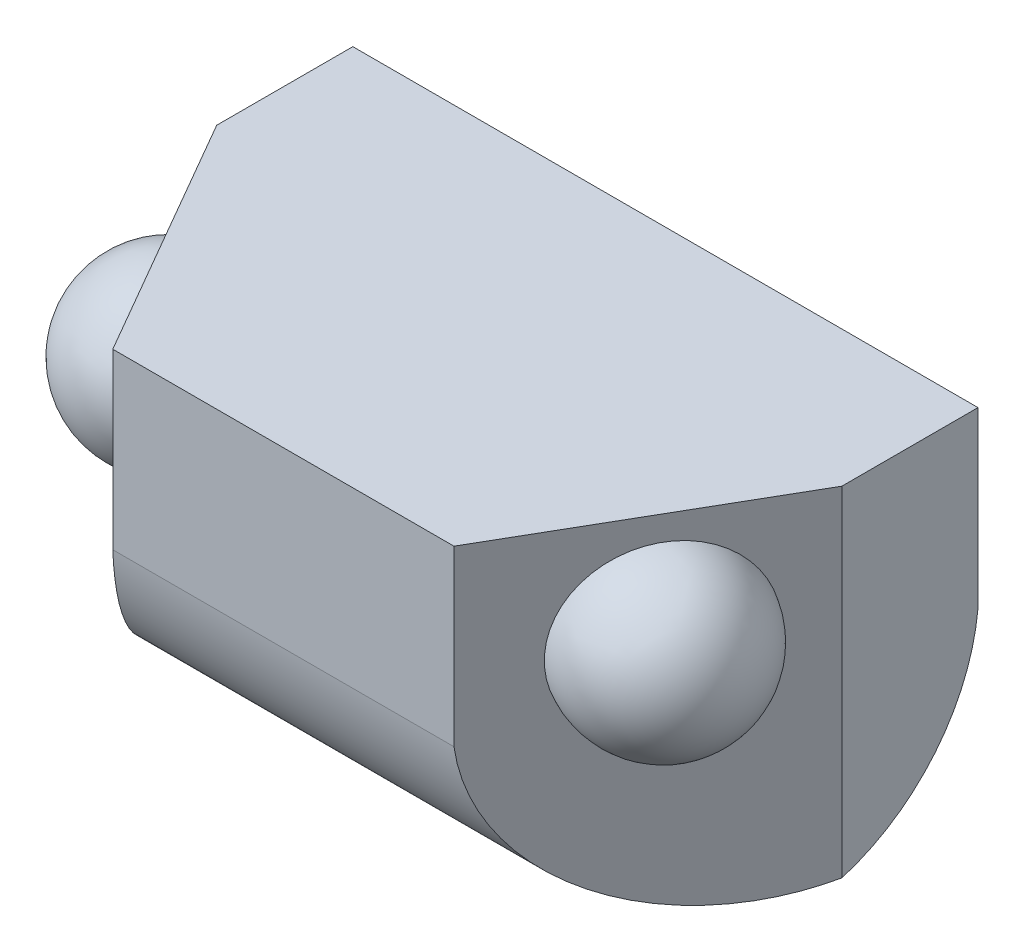
from build123d import *

# Parameters (mm, degrees)
SKETCH1_W                = 180
SKETCH1_H                = 110
BOSS_EXTRUDE1_DEPTH      = 50
BOSS_EXTRUDE2_DEPTH      = 180
CUT_EXTRUDE1_DEPTH       = 146.344418537
BOSS_EXTRUDE5_DEPTH      = 10
BOSS_EXTRUDE5_DEPTH_BACK = 10
SKETCH5_R                = 5


with BuildPart() as part:
    # Sketch1 → Boss-Extrude1 (new body)
    with BuildSketch(Plane(origin=(0, 0, 0), x_dir=(1, 0, 0), z_dir=(0, 1, 0))):
        Rectangle(SKETCH1_W, SKETCH1_H)
    extrude(amount=BOSS_EXTRUDE1_DEPTH)

    # Sketch2 → Boss-Extrude2 (add)
    with BuildSketch(Plane.ZY.offset(90)):
        with BuildLine():
            Line((-55, 0), (55, 0))
            ThreePointArc((55, 0), (0, -50), (-55, 0))
        make_face()
    extrude(amount=-BOSS_EXTRUDE2_DEPTH)

    # Sketch3 → Cut-Extrude1 (cut, through all)
    with BuildSketch(Plane(origin=(0, 50, 0), x_dir=(1, 0, 0), z_dir=(0, 1, 0))):
        Polygon((-49.118803686, -55), (-90, 15.808309091), (-90, -55), align=None)
    cut_extrude1 = extrude(amount=-CUT_EXTRUDE1_DEPTH, mode=Mode.SUBTRACT)

    # Mirror1: Cut-Extrude1 across plane
    add(cut_extrude1.mirror(Plane(origin=(0, 0, 0), x_dir=(0, 0, 1), z_dir=(1, 0, 0))), mode=Mode.SUBTRACT)

    # Sketch5 → Boss-Extrude5 (add, two sides: drawn at the far end of the back side and taken through both)
    with BuildSketch(Plane(origin=(0, 0, -55), x_dir=(-1, 0, 0), z_dir=(0, 0, -1)).offset(-BOSS_EXTRUDE5_DEPTH_BACK)):
        Circle(SKETCH5_R)
    extrude(amount=BOSS_EXTRUDE5_DEPTH + BOSS_EXTRUDE5_DEPTH_BACK)

    # Sketch4 → Revolve1 (revolve)
    with BuildSketch(Plane(origin=(-60.654801368, 0, 35.019065898), x_dir=(0.49999999999999495, 0, 0.8660254037844417), z_dir=(-0.8660254037844417, 0, 0.49999999999999495))):
        with BuildLine():
            ThreePointArc((-20.965161058, 42.942576489), (4.034838942, 17.942576489), (-20.965161058, -7.057423511))
            Line((-20.965161058, -7.057423511), (-20.965161058, 42.942576489))
        make_face()
    revolve1 = revolve(axis=Axis((-71.137381897, 42.942576489, 16.862703827), (0, -1, 0)))

    # Mirror2: Revolve1 across plane
    add(revolve1.mirror(Plane(origin=(0, 0, 0), x_dir=(0, 0, 1), z_dir=(1, 0, 0))))


solid = part.part
